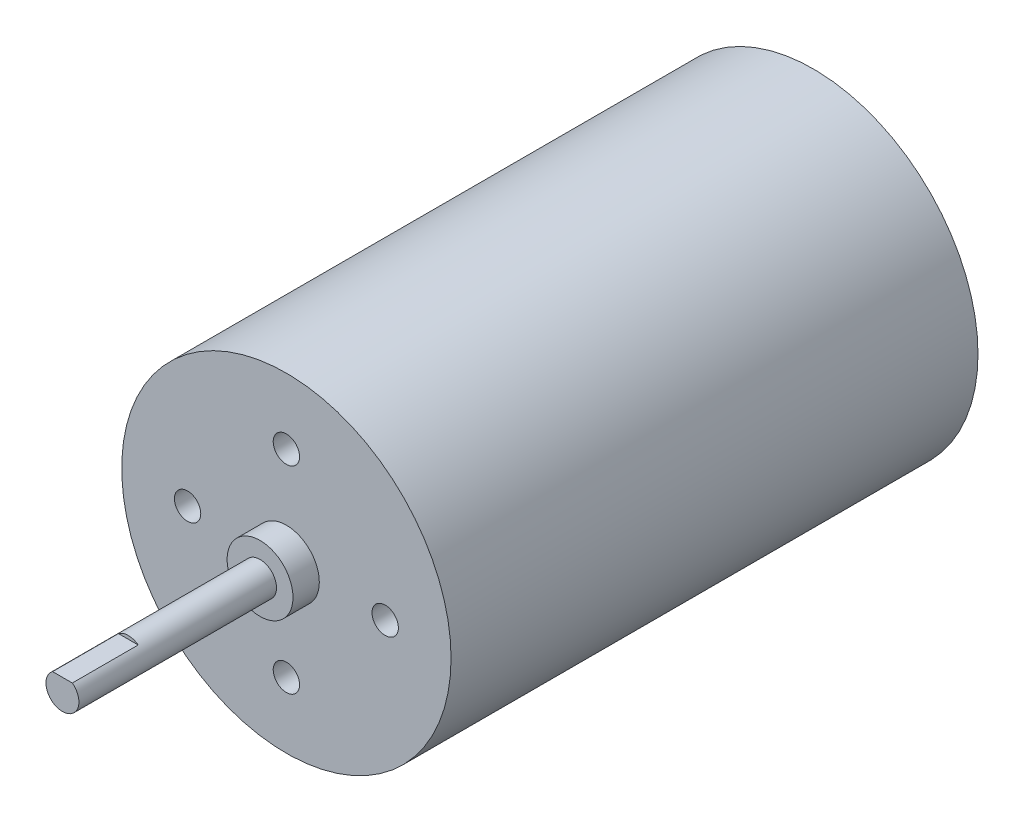
from build123d import *

# Parameters (mm, degrees)
SKETCH1_R           = 15.875
BOSS_EXTRUDE1_DEPTH = 50.8
SKETCH2_R           = 6.35
BOSS_EXTRUDE2_DEPTH = 6.35
SKETCH3_R           = 1.5875
BOSS_EXTRUDE3_DEPTH = 3.175
SKETCH4_R           = 3.175
BOSS_EXTRUDE4_DEPTH = 2.54
BOSS_EXTRUDE5_START = 19.05
SKETCH5_R           = 1.5875
BOSS_EXTRUDE5_DEPTH = 19.05
CUT_EXTRUDE1_DEPTH  = 6.35
SKETCH7_R           = 1.27
CUT_EXTRUDE2_DEPTH  = 8.89


with BuildPart() as part:
    # Sketch1 → Boss-Extrude1 (new body)
    with BuildSketch(Plane.XY):
        Circle(SKETCH1_R)
    extrude(amount=BOSS_EXTRUDE1_DEPTH)

    # Sketch2 → Boss-Extrude2 (add)
    with BuildSketch(Plane(origin=(0, 0, 0), x_dir=(-1, 0, 0), z_dir=(0, 0, -1))):
        with Locations(Location((0, 0, 0), (0, 0, 180))):
            Circle(SKETCH2_R)
    extrude(amount=BOSS_EXTRUDE2_DEPTH)

    # Sketch3 → Boss-Extrude3 (add)
    with BuildSketch(Plane(origin=(0, 0, -6.35), x_dir=(-1, 0, 0), z_dir=(0, 0, -1))):
        Circle(SKETCH3_R)
    extrude(amount=BOSS_EXTRUDE3_DEPTH)

    # Sketch4 → Boss-Extrude4 (add)
    with BuildSketch(Plane.XY.offset(50.8)):
        Circle(SKETCH4_R)
    extrude(amount=BOSS_EXTRUDE4_DEPTH)

    # Sketch5 → Boss-Extrude5 (add)
    with BuildSketch(Plane.XY.offset(53.34).offset(BOSS_EXTRUDE5_START)):
        with Locations(Location((0, 0, 0), (0, 0, 180))):
            Circle(SKETCH5_R)
    extrude(amount=-BOSS_EXTRUDE5_DEPTH)

    # Sketch6 → Cut-Extrude1 (cut)
    with BuildSketch(Plane.XY.offset(72.39)):
        with BuildLine():
            Line((-0.9525, 1.27), (0.9525, 1.27))
            ThreePointArc((0.9525, 1.27), (0, 1.5875), (-0.9525, 1.27))
        make_face()
    extrude(amount=-CUT_EXTRUDE1_DEPTH, mode=Mode.SUBTRACT)

    # Sketch7 → Cut-Extrude2 (cut)
    with BuildSketch(Plane.XY.offset(50.8)):
        with Locations((0, 9.525)):
            Circle(SKETCH7_R)
        with Locations((9.525, 0)):
            Circle(SKETCH7_R)
        with Locations((0, -9.525)):
            Circle(SKETCH7_R)
        with Locations((-9.525, 0)):
            Circle(SKETCH7_R)
    extrude(amount=-CUT_EXTRUDE2_DEPTH, mode=Mode.SUBTRACT)


solid = part.part
